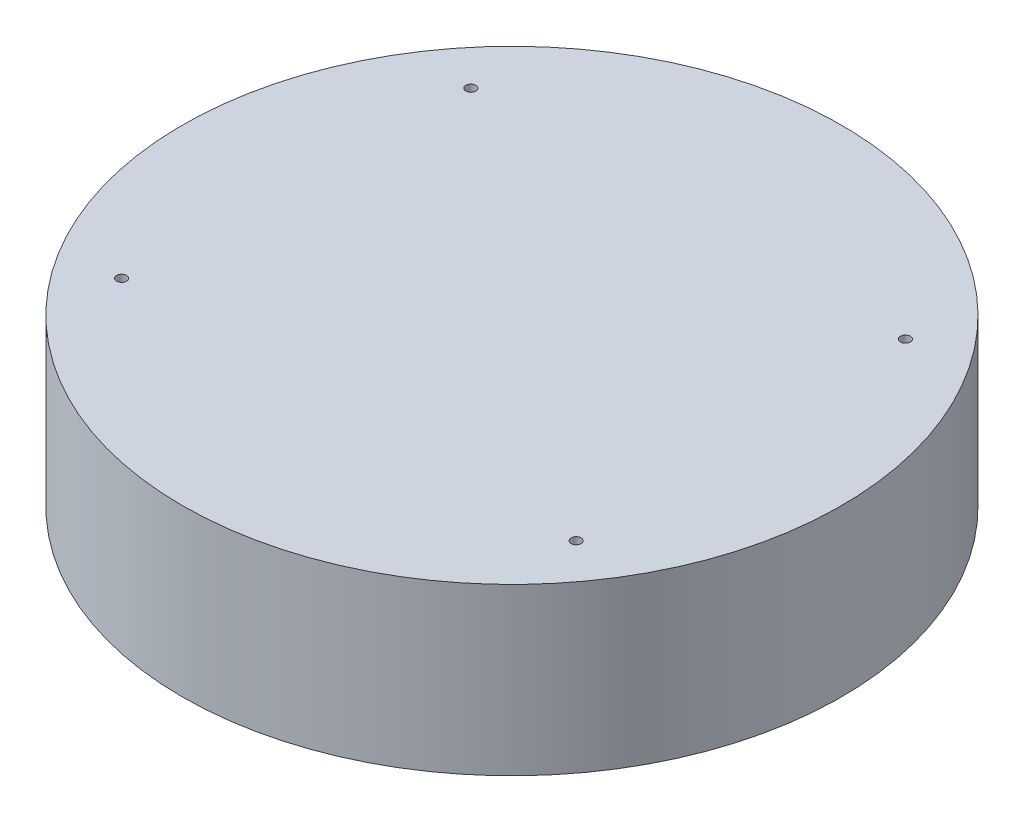
from build123d import *

# Parameters (mm, degrees)
SKETCH1_R           = 164.95
BOSS_EXTRUDE1_DEPTH = 82.94
SKETCH2_R           = 2.5
CUT_EXTRUDE1_DEPTH  = 5


with BuildPart() as part:
    # Sketch1 → Boss-Extrude1 (new body)
    with BuildSketch(Plane(origin=(0, 0, 0), x_dir=(1, 0, 0), z_dir=(0, 1, 0))):
        with Locations(Location((0, 0, 0), (0, 0, 270))):
            Circle(SKETCH1_R)
    extrude(amount=BOSS_EXTRUDE1_DEPTH)

    # Sketch2 → Cut-Extrude1 (cut)
    with BuildSketch(Plane(origin=(0, 82.94, 0), x_dir=(1, 0, 0), z_dir=(0, 1, 0))):
        with Locations(Location((-108.75, 88.167099873, 0), (0, 0, 270))):
            Circle(SKETCH2_R)
        with Locations(Location((108.75, 88.167099873, 0), (0, 0, 270))):
            Circle(SKETCH2_R)
        with Locations(Location((-113.75, -81.614566715, 0), (0, 0, 270))):
            Circle(SKETCH2_R)
        with Locations(Location((113.75, -81.614566715, 0), (0, 0, 270))):
            Circle(SKETCH2_R)
    extrude(amount=-CUT_EXTRUDE1_DEPTH, mode=Mode.SUBTRACT)


solid = part.part
